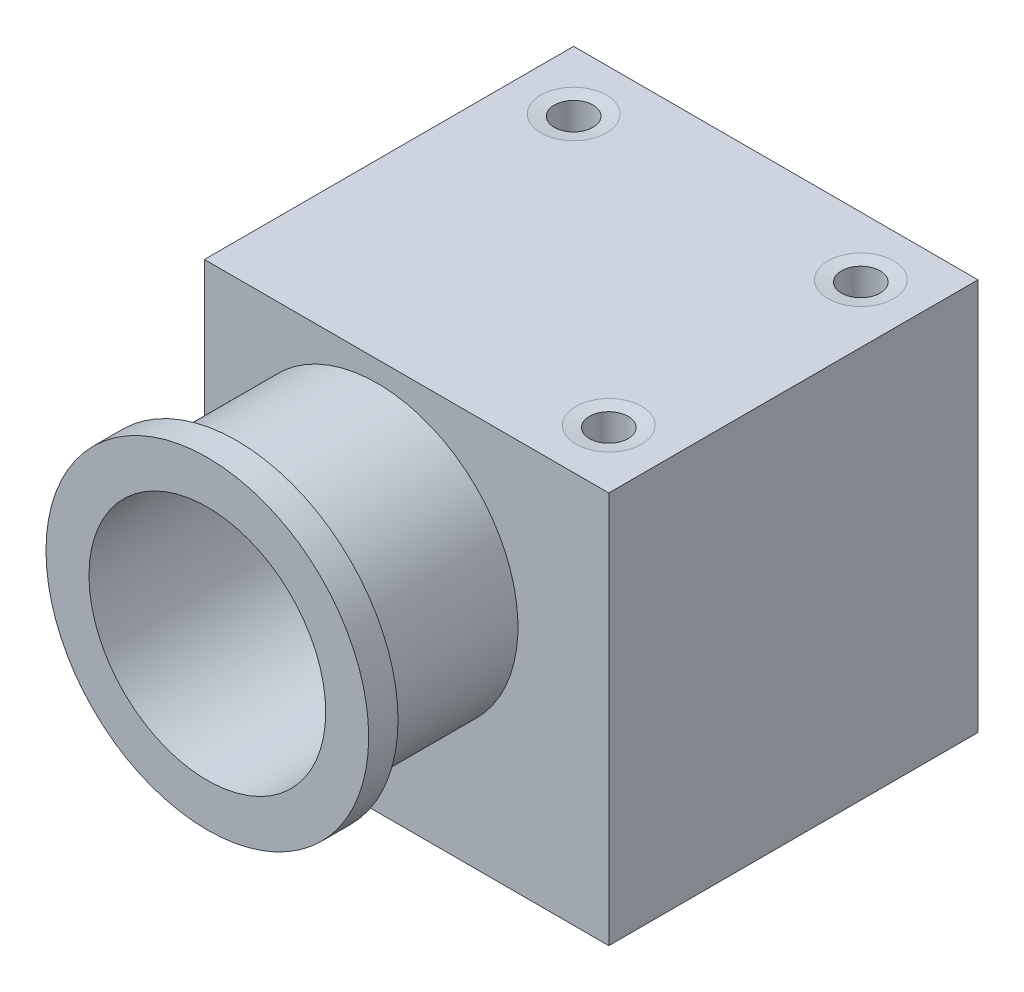
from build123d import *

# Parameters (mm, degrees)
SKETCH1_W           = 14.986
SKETCH1_H           = 16.9926
BOSS_EXTRUDE4_DEPTH = 24.1554
SKETCH10_R          = 1.4224
CUT_EXTRUDE6_DEPTH  = 24.1554
SKETCH11_R          = 3.2639
CUT_EXTRUDE7_DEPTH  = 19.558
SKETCH12_R          = 5.1308
CUT_EXTRUDE8_DEPTH  = 18.288
SKETCH13_W          = 14.986
SKETCH13_H          = 16.9926
SKETCH13_R          = 5.1308
CUT_EXTRUDE9_DEPTH  = 7.366
BOSS_EXTRUDE5_START = 6.096
SKETCH14_R          = 6.096
SKETCH14_R_2        = 5.1308
BOSS_EXTRUDE5_DEPTH = 6.096
BOSS_EXTRUDE6_START = 1.27
SKETCH15_R          = 6.9926
SKETCH15_R_2        = 5.1308
BOSS_EXTRUDE6_DEPTH = 1.27
SKETCH16_W          = 14.986
SKETCH16_H          = 16.9926
CUT_EXTRUDE10_DEPTH = 0.7874
SKETCH18_W          = 16.002
SKETCH18_H          = 16.9926
BOSS_EXTRUDE7_DEPTH = 2.54
SKETCH19_R          = 0.8382
CUT_EXTRUDE11_DEPTH = 20.32


with BuildPart() as part:
    # Sketch1 → Boss-Extrude4 (new body)
    with BuildSketch(Plane.XY):
        Rectangle(SKETCH1_W, SKETCH1_H)
    extrude(amount=-BOSS_EXTRUDE4_DEPTH)

    # Sketch10 → Cut-Extrude6 (cut)
    with BuildSketch(Plane.XY):
        with Locations((0, 1.5037)):
            Circle(SKETCH10_R)
    extrude(amount=-CUT_EXTRUDE6_DEPTH, mode=Mode.SUBTRACT)

    # Sketch11 → Cut-Extrude7 (cut)
    with BuildSketch(Plane.XY):
        with Locations((0, 1.5037)):
            Circle(SKETCH11_R)
    extrude(amount=-CUT_EXTRUDE7_DEPTH, mode=Mode.SUBTRACT)

    # Sketch12 → Cut-Extrude8 (cut)
    with BuildSketch(Plane.XY):
        with Locations((0, 1.5037)):
            Circle(SKETCH12_R)
    extrude(amount=-CUT_EXTRUDE8_DEPTH, mode=Mode.SUBTRACT)

    # Sketch13 → Cut-Extrude9 (cut)
    with BuildSketch(Plane.XY):
        Rectangle(SKETCH13_W, SKETCH13_H)
        with Locations((0, 1.5037)):
            Circle(SKETCH13_R, mode=Mode.SUBTRACT)
    extrude(amount=-CUT_EXTRUDE9_DEPTH, mode=Mode.SUBTRACT)

    # Sketch14 → Boss-Extrude5 (add)
    with BuildSketch(Plane.XY.offset(-7.366).offset(BOSS_EXTRUDE5_START)):
        with Locations(Location((0, 1.5037, 0), (0, 0, 180))):
            Circle(SKETCH14_R)
        with Locations((0, 1.5037)):
            Circle(SKETCH14_R_2, mode=Mode.SUBTRACT)
    extrude(amount=-BOSS_EXTRUDE5_DEPTH)

    # Sketch15 → Boss-Extrude6 (add)
    with BuildSketch(Plane.XY.offset(-1.27).offset(BOSS_EXTRUDE6_START)):
        with Locations((0, 1.5037)):
            Circle(SKETCH15_R)
        with Locations((0, 1.5037)):
            Circle(SKETCH15_R_2, mode=Mode.SUBTRACT)
    extrude(amount=-BOSS_EXTRUDE6_DEPTH)

    # Sketch16 → Cut-Extrude10 (cut)
    with BuildSketch(Plane(origin=(0, 0, -24.1554), x_dir=(-1, 0, 0), z_dir=(0, 0, -1))):
        Rectangle(SKETCH16_W, SKETCH16_H)
    extrude(amount=-CUT_EXTRUDE10_DEPTH, mode=Mode.SUBTRACT)

    # Sketch18 → Boss-Extrude7 (add)
    with BuildSketch(Plane(origin=(7.493, 0, 0), x_dir=(0, 0, -1), z_dir=(1, 0, 0))):
        with Locations((15.367, 0)):
            Rectangle(SKETCH18_W, SKETCH18_H)
    extrude(amount=BOSS_EXTRUDE7_DEPTH)

    # Sketch19 → Cut-Extrude11 (cut)
    with BuildSketch(Plane(origin=(0, 8.4963, 0), x_dir=(1, 0, 0), z_dir=(0, 1, 0))):
        with Locations(Location((-4.953, 20.828, 0), (0, 0, 270))):
            Circle(SKETCH19_R)
        with Locations(Location((7.493, 20.828, 0), (0, 0, 270))):
            Circle(SKETCH19_R)
        with Locations(Location((7.493, 9.906, 0), (0, 0, 270))):
            Circle(SKETCH19_R)
    extrude(amount=-CUT_EXTRUDE11_DEPTH, mode=Mode.SUBTRACT)

    # Cut-Extrude13 cone 1 section (through the dimple's axis) → Cut-Extrude13 (revolve, cut)
    with BuildSketch(Plane(origin=(-4.953, 8.4963, -20.828), x_dir=(0, 0, 1), z_dir=(1, 0, 0))):
        Polygon((0, 0), (1.4224, 0), (0, 0.199905283), align=None)
    revolve(axis=Axis((-4.953, 8.4963, -20.828), (0, -1, 0)), mode=Mode.SUBTRACT)

    # Cut-Extrude13 cone 2 section (through the dimple's axis) → Cut-Extrude13 cone 2 (revolve, cut)
    with BuildSketch(Plane(origin=(7.493, 8.4963, -20.828), x_dir=(0, 0, 1), z_dir=(1, 0, 0))):
        Polygon((0, 0), (1.4224, 0), (0, 0.199905283), align=None)
    revolve(axis=Axis((7.493, 8.4963, -20.828), (0, -1, 0)), mode=Mode.SUBTRACT)

    # Cut-Extrude13 cone 3 section (through the dimple's axis) → Cut-Extrude13 cone 3 (revolve, cut)
    with BuildSketch(Plane(origin=(7.493, 8.4963, -9.906), x_dir=(0, 0, 1), z_dir=(1, 0, 0))):
        Polygon((0, 0), (1.4224, 0), (0, 0.199905283), align=None)
    revolve(axis=Axis((7.493, 8.4963, -9.906), (0, -1, 0)), mode=Mode.SUBTRACT)


solid = part.part
